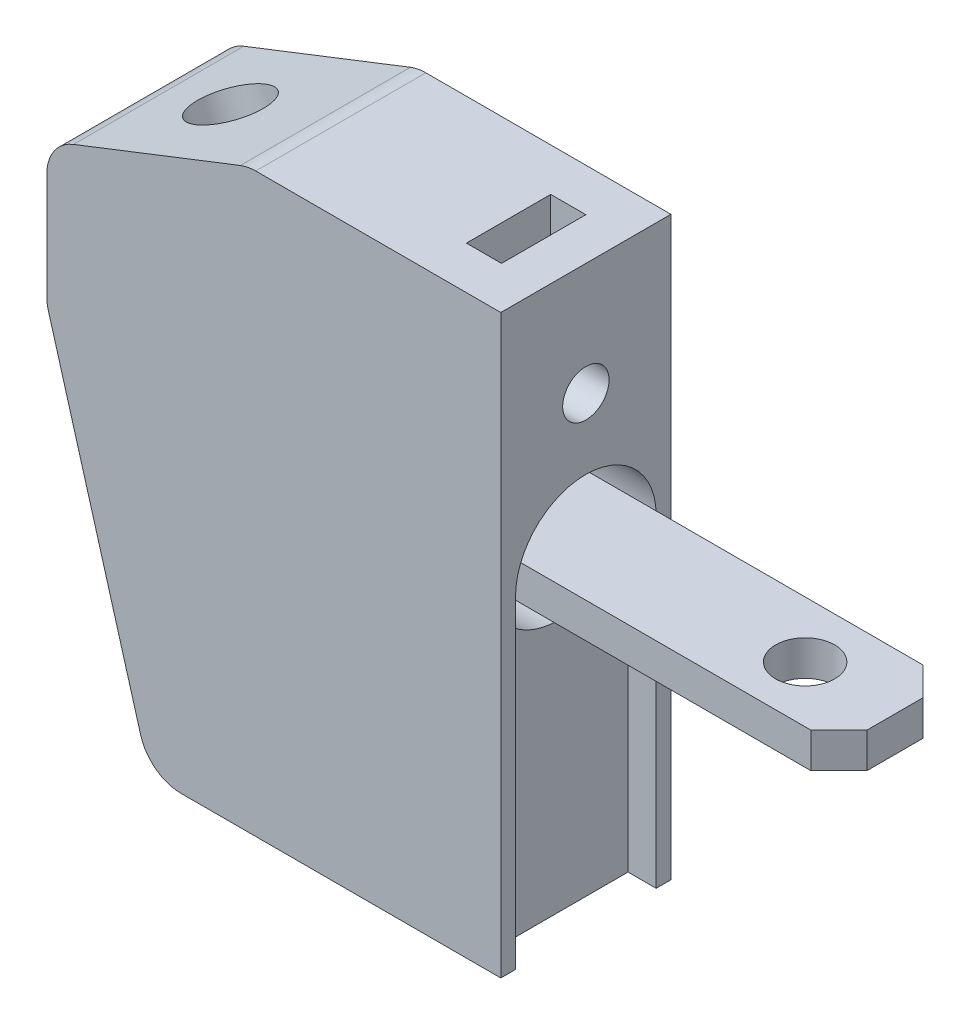
from build123d import *
from build123d.topology import SkipClean

# Parameters (mm, degrees)
EXTRUDE_1_DEPTH     = 12.1
SKETCH_2_W          = 2.5
SKETCH_2_H          = 6
CUT_EXTRUDE_1_DEPTH = 5
SKETCH_3_R          = 2.5
CUT_EXTRUDE_2_DEPTH = 4
CUT_EXTRUDE_3_DEPTH = 3
SKETCH_5_W          = 6
SKETCH_5_H          = 12
CUT_EXTRUDE_4_DEPTH = 5
FILLET_1_R          = 3
SKETCH_6_R          = 5
SKETCH_6_R_2        = 1.65
CUT_EXTRUDE_5_DEPTH = 5
SKETCH_7_W          = 8
SKETCH_7_H          = 2.5
EXTRUDE_2_DEPTH     = 27
SKETCH_8_R          = 2.1
CUT_EXTRUDE_6_DEPTH = 30
CHAMFER_1_SIZE      = 2
CUT_EXTRUDE_7_DEPTH = 2


with BuildPart() as part:
    # Эскиз1 → Вытянуть1 (new body)
    with BuildSketch(Plane.XY):
        Polygon((0, -23), (0, 18), (-18, 18), (-32.3, 12.413885007), (-32.3, 2.413885007), (-25, -23), align=None)
    extrude(amount=EXTRUDE_1_DEPTH)

    # Эскиз2 → Вырез-Вытянуть1 (cut)
    with BuildSketch(Plane(origin=(0, 18, 0), x_dir=(1, 0, 0), z_dir=(0, 1, 0))):
        with Locations((-4.25, -6.05)):
            Rectangle(SKETCH_2_W, SKETCH_2_H)
    extrude(amount=-CUT_EXTRUDE_1_DEPTH, mode=Mode.SUBTRACT)

    # Эскиз3 → Вырез-Вытянуть2 (cut)
    with BuildSketch(Plane(origin=(-8.483646071, 21.717443871, 0), x_dir=(0.9314534311844429, 0.3638605578167664, 0), z_dir=(-0.3638605578167664, 0.931453431184443, 0))):
        with Locations(Location((-18.036153415, -6.05, 0), (0, 0, 180))):
            Circle(SKETCH_3_R)
    extrude(amount=-CUT_EXTRUDE_2_DEPTH, mode=Mode.SUBTRACT)

    # Эскиз4 → Вырез-Вытянуть3 (cut)
    with SkipClean():  # the faces are left unmerged after this step: merging them gives an invalid solid
        with BuildSketch(Plane(origin=(-7.028203839, 17.991630147, 0), x_dir=(0.9314534311844429, 0.3638605578167665, 0), z_dir=(-0.36386055781676646, 0.9314534311844428, 0))):
            with BuildLine():
                Line((-20.093115316, -7.470882731), (-16.615270683, -3.993038099))
                ThreePointArc((-16.615270683, -3.993038099), (-16.268386462, -4.282233047), (-15.979191513, -4.629117269))
                Line((-15.979191513, -4.629117269), (-19.457036146, -8.106961901))
                ThreePointArc((-19.457036146, -8.106961901), (-19.803920367, -7.817766953), (-20.093115316, -7.470882731))
            make_face()
        extrude(amount=-CUT_EXTRUDE_3_DEPTH, mode=Mode.SUBTRACT)

    # Эскиз5 → Вырез-Вытянуть4 (cut)
    with SkipClean():  # the faces are left unmerged after this step: merging them gives an invalid solid
        with BuildSketch(Plane(origin=(-29.1975513, -8.386837527, 0), x_dir=(0, 0, 1), z_dir=(-0.9611344752582023, -0.27608064124480053, 0))):
            with Locations((6.05, -1.983302044)):
                Rectangle(SKETCH_5_W, SKETCH_5_H)
        extrude(amount=-CUT_EXTRUDE_4_DEPTH, mode=Mode.SUBTRACT)

    # Скругление1
    fillet_1_edges = [part.edges().sort_by_distance(p)[0] for p in [
        (-32.3, 12.413885007, 6.05),
        (-18, 18, 6.05),
        (-25, -23, 6.05),
        (-32.3, 2.413885007, 6.05),
    ]]
    fillet(fillet_1_edges, radius=FILLET_1_R)

    # Эскиз6 → Вырез-Вытянуть5 (cut)
    with SkipClean():  # the faces are left unmerged after this step: merging them gives an invalid solid
        with BuildSketch(Plane(origin=(0, 0, 0), x_dir=(0, 0, -1), z_dir=(1, 0, 0))):
            with Locations(Location((-6.05, 0, 0), (0, 0, 90))):
                Circle(SKETCH_6_R)
            with Locations(Location((-6.05, 10, 0), (0, 0, 90))):
                Circle(SKETCH_6_R_2)
        extrude(amount=-CUT_EXTRUDE_5_DEPTH, mode=Mode.SUBTRACT)

    # Эскиз7 → Вытянуть2 (add)
    with SkipClean():  # the faces are left unmerged after this step: merging them gives an invalid solid
        with BuildSketch(Plane(origin=(-5, 0, 0), x_dir=(0, 0, -1), z_dir=(1, 0, 0))):
            with Locations((-6.05, 0)):
                Rectangle(SKETCH_7_W, SKETCH_7_H)
        extrude(amount=EXTRUDE_2_DEPTH)

    # Эскиз8 → Вырез-Вытянуть6 (cut)
    with SkipClean():  # the faces are left unmerged after this step: merging them gives an invalid solid
        with BuildSketch(Plane(origin=(0, 1.25, 0), x_dir=(1, 0, 0), z_dir=(0, 1, 0))):
            with Locations(Location((15.6, -6.05, 0), (0, 0, 180))):
                Circle(SKETCH_8_R)
        extrude(amount=-CUT_EXTRUDE_6_DEPTH, mode=Mode.SUBTRACT)

    # Фаска1
    chamfer_1_edges = [part.edges().sort_by_distance(p)[0] for p in [
        (22, 0, 10.05),
        (22, 0, 2.05),
    ]]
    chamfer(chamfer_1_edges, length=CHAMFER_1_SIZE)

    # Эскиз9 → Вырез-Вытянуть7 (cut)
    with SkipClean():  # the faces are left unmerged after this step: merging them gives an invalid solid
        with BuildSketch(Plane(origin=(0, 0, 0), x_dir=(0, 0, -1), z_dir=(1, 0, 0))):
            with BuildLine():
                Line((-11.05, -23), (-1.05, -23))
                Line((-1.05, -23), (-1.05, 0))
                ThreePointArc((-1.05, 0), (-6.05, -5), (-11.05, 0))
                Line((-11.05, 0), (-11.05, -23))
            make_face()
        extrude(amount=-CUT_EXTRUDE_7_DEPTH, mode=Mode.SUBTRACT)


solid = part.part
